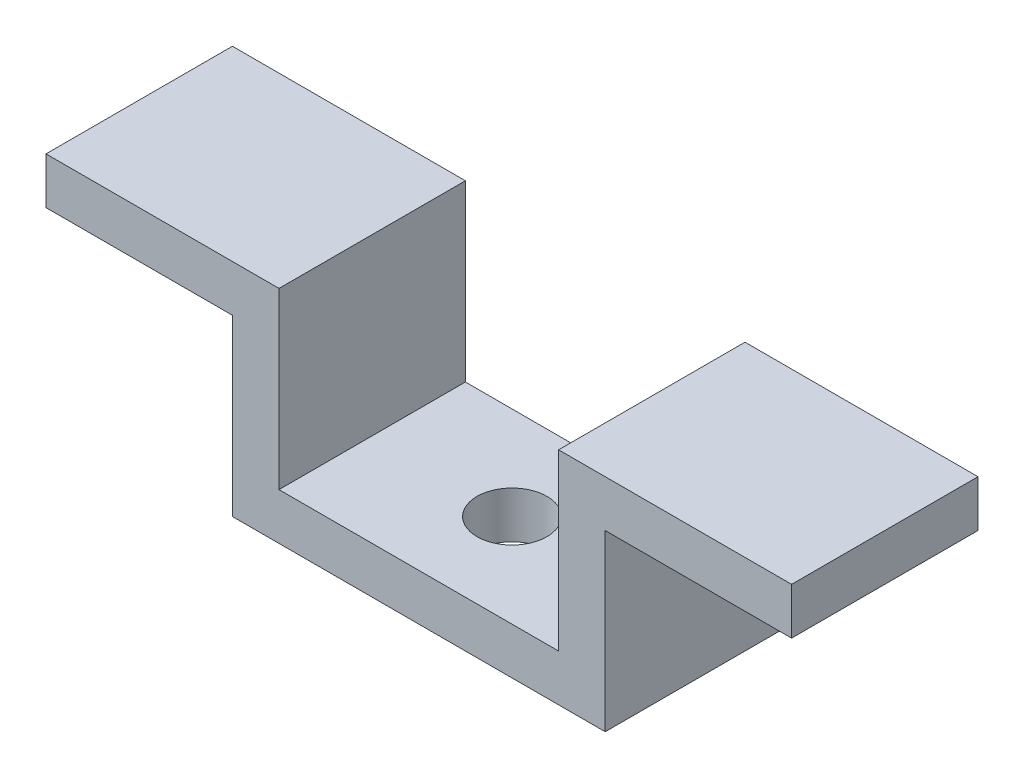
from build123d import *

# Parameters (mm, degrees)
BOSS_EXTRUDE1_DEPTH = 25.4
CUT_EXTRUDE1_REACH  = 63.561
SKETCH2_R           = 4.7625


with BuildPart() as part:
    # Sketch1 → Boss-Extrude1 (new body)
    with BuildSketch(Plane.XY):
        Polygon((0, 0), (25.4, 0), (25.4, 23.749), (50.8, 23.749), (50.8, 30.099), (19.05, 30.099), (19.05, 6.35), (0, 6.35), align=None)
    extrude(amount=BOSS_EXTRUDE1_DEPTH)

    # Mirror1: part across plane


with BuildPart() as part_1:
    add(part.part)
    add(part.part.mirror(Plane(origin=(0, 6.35, 25.4), x_dir=(0, 0, 1), z_dir=(1, 0, 0))))

    # Sketch2 → Cut-Extrude1 (cut, up to next)
    with BuildSketch(Plane(origin=(0, 6.35, 0), x_dir=(1, 0, 0), z_dir=(0, 1, 0)), mode=Mode.PRIVATE) as cut_extrude1_sk1:
        with Locations(Location((0, -12.7, 0), (0, 0, 180))):
            Circle(SKETCH2_R)
    cut_extrude1_tool1 = extrude(cut_extrude1_sk1.sketch, amount=-CUT_EXTRUDE1_REACH, mode=Mode.PRIVATE) & part_1.part
    add(cut_extrude1_tool1.solids().sort_by_distance((0, 6.35, 12.7))[0], mode=Mode.SUBTRACT)


solid = part_1.part
